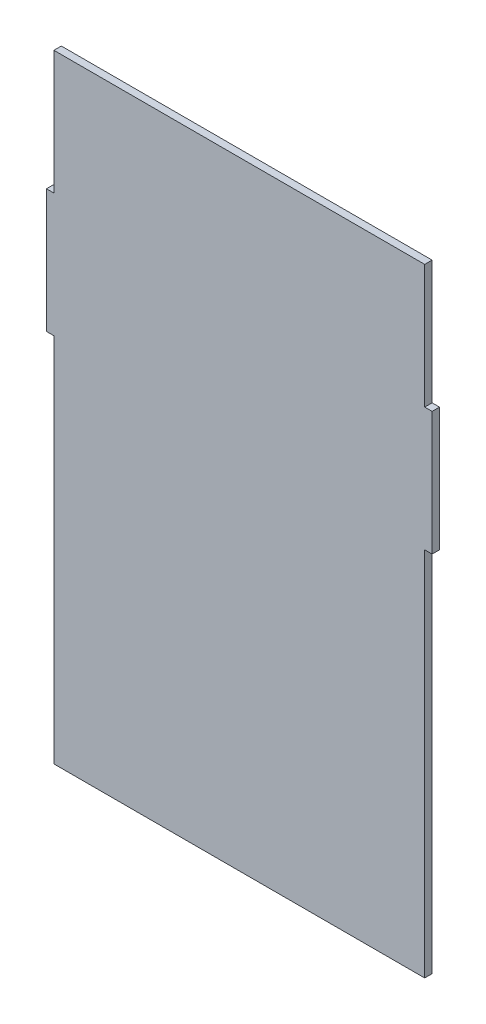
from build123d import *

# Parameters (mm, degrees)
SALIENTE_EXTRUIR1_DEPTH = 3


with BuildPart() as part:
    # Croquis1 → Saliente-Extruir1 (new body)
    with BuildSketch(Plane.XY):
        Polygon((0, 200), (0, 250), (150, 250), (150, 200), (153, 200), (153, 150), (150, 150), (150, 0), (0, 0), (0, 150), (-3, 150), (-3, 200), align=None)
    extrude(amount=SALIENTE_EXTRUIR1_DEPTH)


solid = part.part
